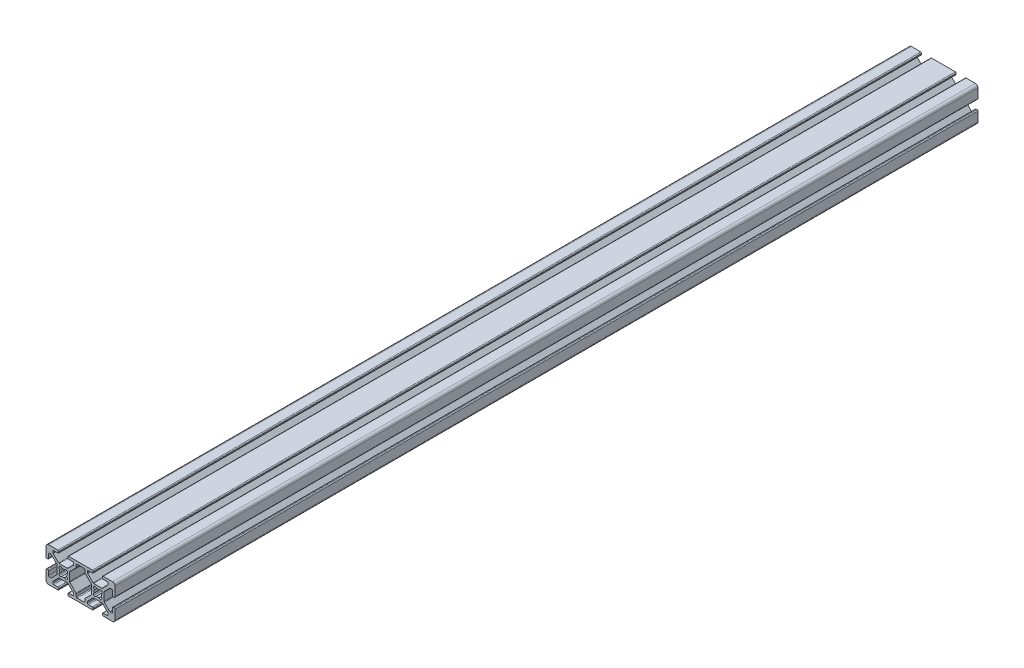
from build123d import *

# Parameters (mm, degrees)
EXTRUDE1_DEPTH = 500


with BuildPart() as part:
    # Sketch1 → Extrude1 (new body)
    with BuildSketch(Plane.XY):
        with BuildLine():
            Line((-36.908207136, -63.334998016), (-32.140368459, -63.334998016))
            ThreePointArc((-32.140368459, -63.334998016), (-31.945965275, -63.373667213), (-31.781158214, -63.483787771))
            Line((-31.781158214, -63.483787771), (-28.678077553, -66.586868432))
            ThreePointArc((-28.678077553, -66.586868432), (-28.567956995, -66.751675493), (-28.529287798, -66.946078677))
            Line((-28.529287798, -66.946078677), (-28.529287798, -67.671998016))
            ThreePointArc((-28.529287798, -67.671998016), (-28.678077553, -68.03120826), (-29.037287798, -68.179998016))
            Line((-29.037287798, -68.179998016), (-31.386287798, -68.179998016))
            ThreePointArc((-31.386287798, -68.179998016), (-31.745498042, -68.328787771), (-31.894287798, -68.687998016))
            Line((-31.894287798, -68.687998016), (-31.894287798, -69.171998016))
            ThreePointArc((-31.894287798, -69.171998016), (-31.745498042, -69.53120826), (-31.386287798, -69.679998016))
            Line((-31.386287798, -69.679998016), (-17.662287798, -69.679998016))
            ThreePointArc((-17.662287798, -69.679998016), (-17.303077553, -69.53120826), (-17.154287798, -69.171998016))
            Line((-17.154287798, -69.171998016), (-17.154287798, -68.687998016))
            ThreePointArc((-17.154287798, -68.687998016), (-17.303077553, -68.328787771), (-17.662287798, -68.179998016))
            Line((-17.662287798, -68.179998016), (-20.011287798, -68.179998016))
            ThreePointArc((-20.011287798, -68.179998016), (-20.370498042, -68.03120826), (-20.519287798, -67.671998016))
            Line((-20.519287798, -67.671998016), (-20.519287798, -66.946078677))
            ThreePointArc((-20.519287798, -66.946078677), (-20.4806186, -66.751675493), (-20.370498042, -66.586868432))
            Line((-20.370498042, -66.586868432), (-17.267417381, -63.483787771))
            ThreePointArc((-17.267417381, -63.483787771), (-17.10261032, -63.373667213), (-16.908207136, -63.334998016))
            Line((-16.908207136, -63.334998016), (-12.140368459, -63.334998016))
            ThreePointArc((-12.140368459, -63.334998016), (-11.945965275, -63.373667213), (-11.781158214, -63.483787771))
            Line((-11.781158214, -63.483787771), (-8.678077553, -66.586868432))
            ThreePointArc((-8.678077553, -66.586868432), (-8.567956995, -66.751675493), (-8.529287798, -66.946078677))
            Line((-8.529287798, -66.946078677), (-8.529287798, -67.671998016))
            ThreePointArc((-8.529287798, -67.671998016), (-8.678077553, -68.03120826), (-9.037287798, -68.179998016))
            Line((-9.037287798, -68.179998016), (-11.386287798, -68.179998016))
            ThreePointArc((-11.386287798, -68.179998016), (-11.745498042, -68.328787771), (-11.894287798, -68.687998016))
            Line((-11.894287798, -68.687998016), (-11.894287798, -69.171998016))
            ThreePointArc((-11.894287798, -69.171998016), (-11.745498042, -69.53120826), (-11.386287798, -69.679998016))
            Line((-11.386287798, -69.679998016), (-6.024287798, -69.679998016))
            ThreePointArc((-6.024287798, -69.679998016), (-4.963627626, -69.240658187), (-4.524287798, -68.179998016))
            Line((-4.524287798, -68.179998016), (-4.524287798, -62.817998016))
            ThreePointArc((-4.524287798, -62.817998016), (-4.673077553, -62.458787771), (-5.032287798, -62.309998016))
            Line((-5.032287798, -62.309998016), (-5.516287798, -62.309998016))
            ThreePointArc((-5.516287798, -62.309998016), (-5.875498042, -62.458787771), (-6.024287798, -62.817998016))
            Line((-6.024287798, -62.817998016), (-6.024287798, -65.166998016))
            ThreePointArc((-6.024287798, -65.166998016), (-6.173077553, -65.52620826), (-6.532287798, -65.674998016))
            Line((-6.532287798, -65.674998016), (-7.258207136, -65.674998016))
            ThreePointArc((-7.258207136, -65.674998016), (-7.45261032, -65.636328818), (-7.617417381, -65.52620826))
            Line((-7.617417381, -65.52620826), (-10.720498042, -62.423127599))
            ThreePointArc((-10.720498042, -62.423127599), (-10.8306186, -62.258320538), (-10.869287798, -62.063917354))
            Line((-10.869287798, -62.063917354), (-10.869287798, -57.296078677))
            ThreePointArc((-10.869287798, -57.296078677), (-10.8306186, -57.101675493), (-10.720498042, -56.936868432))
            Line((-10.720498042, -56.936868432), (-7.617417381, -53.833787771))
            ThreePointArc((-7.617417381, -53.833787771), (-7.45261032, -53.723667213), (-7.258207136, -53.684998016))
            Line((-7.258207136, -53.684998016), (-6.532287798, -53.684998016))
            ThreePointArc((-6.532287798, -53.684998016), (-6.173077553, -53.833787771), (-6.024287798, -54.192998016))
            Line((-6.024287798, -54.192998016), (-6.024287798, -56.541998016))
            ThreePointArc((-6.024287798, -56.541998016), (-5.875498042, -56.90120826), (-5.516287798, -57.049998016))
            Line((-5.516287798, -57.049998016), (-5.032287798, -57.049998016))
            ThreePointArc((-5.032287798, -57.049998016), (-4.673077553, -56.90120826), (-4.524287798, -56.541998016))
            Line((-4.524287798, -56.541998016), (-4.524287798, -51.179998016))
            ThreePointArc((-4.524287798, -51.179998016), (-4.963627626, -50.119337844), (-6.024287798, -49.679998016))
            Line((-6.024287798, -49.679998016), (-11.386287798, -49.679998016))
            ThreePointArc((-11.386287798, -49.679998016), (-11.745498042, -49.828787771), (-11.894287798, -50.187998016))
            Line((-11.894287798, -50.187998016), (-11.894287798, -50.671998016))
            ThreePointArc((-11.894287798, -50.671998016), (-11.745498042, -51.03120826), (-11.386287798, -51.179998016))
            Line((-11.386287798, -51.179998016), (-9.037287798, -51.179998016))
            ThreePointArc((-9.037287798, -51.179998016), (-8.678077553, -51.328787771), (-8.529287798, -51.687998016))
            Line((-8.529287798, -51.687998016), (-8.529287798, -52.413917354))
            ThreePointArc((-8.529287798, -52.413917354), (-8.567956995, -52.608320538), (-8.678077553, -52.773127599))
            Line((-8.678077553, -52.773127599), (-11.781158214, -55.87620826))
            ThreePointArc((-11.781158214, -55.87620826), (-11.945965275, -55.986328818), (-12.140368459, -56.024998016))
            Line((-12.140368459, -56.024998016), (-16.908207136, -56.024998016))
            ThreePointArc((-16.908207136, -56.024998016), (-17.10261032, -55.986328818), (-17.267417381, -55.87620826))
            Line((-17.267417381, -55.87620826), (-20.370498042, -52.773127599))
            ThreePointArc((-20.370498042, -52.773127599), (-20.4806186, -52.608320538), (-20.519287798, -52.413917354))
            Line((-20.519287798, -52.413917354), (-20.519287798, -51.687998016))
            ThreePointArc((-20.519287798, -51.687998016), (-20.370498042, -51.328787771), (-20.011287798, -51.179998016))
            Line((-20.011287798, -51.179998016), (-17.662287798, -51.179998016))
            ThreePointArc((-17.662287798, -51.179998016), (-17.303077553, -51.03120826), (-17.154287798, -50.671998016))
            Line((-17.154287798, -50.671998016), (-17.154287798, -50.187998016))
            ThreePointArc((-17.154287798, -50.187998016), (-17.303077553, -49.828787771), (-17.662287798, -49.679998016))
            Line((-17.662287798, -49.679998016), (-31.386287798, -49.679998016))
            ThreePointArc((-31.386287798, -49.679998016), (-31.745498042, -49.828787771), (-31.894287798, -50.187998016))
            Line((-31.894287798, -50.187998016), (-31.894287798, -50.671998016))
            ThreePointArc((-31.894287798, -50.671998016), (-31.745498042, -51.03120826), (-31.386287798, -51.179998016))
            Line((-31.386287798, -51.179998016), (-29.037287798, -51.179998016))
            ThreePointArc((-29.037287798, -51.179998016), (-28.678077553, -51.328787771), (-28.529287798, -51.687998016))
            Line((-28.529287798, -51.687998016), (-28.529287798, -52.413917354))
            ThreePointArc((-28.529287798, -52.413917354), (-28.567956995, -52.608320538), (-28.678077553, -52.773127599))
            Line((-28.678077553, -52.773127599), (-31.781158214, -55.87620826))
            ThreePointArc((-31.781158214, -55.87620826), (-31.945965275, -55.986328818), (-32.140368459, -56.024998016))
            Line((-32.140368459, -56.024998016), (-36.908207136, -56.024998016))
            ThreePointArc((-36.908207136, -56.024998016), (-37.10261032, -55.986328818), (-37.267417381, -55.87620826))
            Line((-37.267417381, -55.87620826), (-40.370498042, -52.773127599))
            ThreePointArc((-40.370498042, -52.773127599), (-40.4806186, -52.608320538), (-40.519287798, -52.413917354))
            Line((-40.519287798, -52.413917354), (-40.519287798, -51.687998016))
            ThreePointArc((-40.519287798, -51.687998016), (-40.370498042, -51.328787771), (-40.011287798, -51.179998016))
            Line((-40.011287798, -51.179998016), (-37.662287798, -51.179998016))
            ThreePointArc((-37.662287798, -51.179998016), (-37.303077553, -51.03120826), (-37.154287798, -50.671998016))
            Line((-37.154287798, -50.671998016), (-37.154287798, -50.187998016))
            ThreePointArc((-37.154287798, -50.187998016), (-37.303077553, -49.828787771), (-37.662287798, -49.679998016))
            Line((-37.662287798, -49.679998016), (-43.024287798, -49.679998016))
            ThreePointArc((-43.024287798, -49.679998016), (-44.084947969, -50.119337844), (-44.524287798, -51.179998016))
            Line((-44.524287798, -51.179998016), (-44.524287798, -56.541998016))
            ThreePointArc((-44.524287798, -56.541998016), (-44.375498042, -56.90120826), (-44.016287798, -57.049998016))
            Line((-44.016287798, -57.049998016), (-43.532287798, -57.049998016))
            ThreePointArc((-43.532287798, -57.049998016), (-43.173077553, -56.90120826), (-43.024287798, -56.541998016))
            Line((-43.024287798, -56.541998016), (-43.024287798, -54.192998016))
            ThreePointArc((-43.024287798, -54.192998016), (-42.875498042, -53.833787771), (-42.516287798, -53.684998016))
            Line((-42.516287798, -53.684998016), (-41.790368459, -53.684998016))
            ThreePointArc((-41.790368459, -53.684998016), (-41.595965275, -53.723667213), (-41.431158214, -53.833787771))
            Line((-41.431158214, -53.833787771), (-38.328077553, -56.936868432))
            ThreePointArc((-38.328077553, -56.936868432), (-38.217956995, -57.101675493), (-38.179287798, -57.296078677))
            Line((-38.179287798, -57.296078677), (-38.179287798, -62.063917354))
            ThreePointArc((-38.179287798, -62.063917354), (-38.217956995, -62.258320538), (-38.328077553, -62.423127599))
            Line((-38.328077553, -62.423127599), (-41.431158214, -65.52620826))
            ThreePointArc((-41.431158214, -65.52620826), (-41.595965275, -65.636328818), (-41.790368459, -65.674998016))
            Line((-41.790368459, -65.674998016), (-42.516287798, -65.674998016))
            ThreePointArc((-42.516287798, -65.674998016), (-42.875498042, -65.52620826), (-43.024287798, -65.166998016))
            Line((-43.024287798, -65.166998016), (-43.024287798, -62.817998016))
            ThreePointArc((-43.024287798, -62.817998016), (-43.173077553, -62.458787771), (-43.532287798, -62.309998016))
            Line((-43.532287798, -62.309998016), (-44.016287798, -62.309998016))
            ThreePointArc((-44.016287798, -62.309998016), (-44.375498042, -62.458787771), (-44.524287798, -62.817998016))
            Line((-44.524287798, -62.817998016), (-44.524287798, -68.179998016))
            ThreePointArc((-44.524287798, -68.179998016), (-44.084947969, -69.240658187), (-43.024287798, -69.679998016))
            Line((-43.024287798, -69.679998016), (-37.662287798, -69.679998016))
            ThreePointArc((-37.662287798, -69.679998016), (-37.303077553, -69.53120826), (-37.154287798, -69.171998016))
            Line((-37.154287798, -69.171998016), (-37.154287798, -68.687998016))
            ThreePointArc((-37.154287798, -68.687998016), (-37.303077553, -68.328787771), (-37.662287798, -68.179998016))
            Line((-37.662287798, -68.179998016), (-40.011287798, -68.179998016))
            ThreePointArc((-40.011287798, -68.179998016), (-40.370498042, -68.03120826), (-40.519287798, -67.671998016))
            Line((-40.519287798, -67.671998016), (-40.519287798, -66.946078677))
            ThreePointArc((-40.519287798, -66.946078677), (-40.4806186, -66.751675493), (-40.370498042, -66.586868432))
            Line((-40.370498042, -66.586868432), (-37.267417381, -63.483787771))
            ThreePointArc((-37.267417381, -63.483787771), (-37.10261032, -63.373667213), (-36.908207136, -63.334998016))
        make_face()
        with BuildLine():
            Line((-16.649188641, -61.984503982), (-16.828793764, -61.804898859))
            ThreePointArc((-16.828793764, -61.804898859), (-17.030225814, -61.036465826), (-16.459421304, -60.483974734))
            ThreePointArc((-16.459421304, -60.483974734), (-16.619787798, -59.679998016), (-16.459421304, -58.876021298))
            ThreePointArc((-16.459421304, -58.876021298), (-17.030225814, -58.323530205), (-16.828793764, -57.555097172))
            Line((-16.828793764, -57.555097172), (-16.649188641, -57.375492049))
            ThreePointArc((-16.649188641, -57.375492049), (-15.880755608, -57.174059999), (-15.328264516, -57.744864509))
            ThreePointArc((-15.328264516, -57.744864509), (-14.524287798, -57.584498016), (-13.72031108, -57.744864509))
            ThreePointArc((-13.72031108, -57.744864509), (-13.167819987, -57.174059999), (-12.399386954, -57.375492049))
            Line((-12.399386954, -57.375492049), (-12.219781831, -57.555097172))
            ThreePointArc((-12.219781831, -57.555097172), (-12.018349781, -58.323530205), (-12.589154291, -58.876021298))
            ThreePointArc((-12.589154291, -58.876021298), (-12.428787798, -59.679998016), (-12.589154291, -60.483974734))
            ThreePointArc((-12.589154291, -60.483974734), (-12.018349781, -61.036465826), (-12.219781831, -61.804898859))
            Line((-12.219781831, -61.804898859), (-12.399386954, -61.984503982))
            ThreePointArc((-12.399386954, -61.984503982), (-13.167819987, -62.185936032), (-13.72031108, -61.615131522))
            ThreePointArc((-13.72031108, -61.615131522), (-14.524287798, -61.775498016), (-15.328264516, -61.615131522))
            ThreePointArc((-15.328264516, -61.615131522), (-15.880755608, -62.185936032), (-16.649188641, -61.984503982))
        make_face(mode=Mode.SUBTRACT)
        with BuildLine():
            Line((-27.029287798, -67.671998016), (-27.029287798, -66.324758333))
            ThreePointArc((-27.029287798, -66.324758333), (-27.067956995, -66.13035515), (-27.178077553, -65.965548089))
            Line((-27.178077553, -65.965548089), (-30.720498042, -62.423127599))
            ThreePointArc((-30.720498042, -62.423127599), (-30.8306186, -62.258320538), (-30.869287798, -62.063917354))
            Line((-30.869287798, -62.063917354), (-30.869287798, -57.296078677))
            ThreePointArc((-30.869287798, -57.296078677), (-30.8306186, -57.101675493), (-30.720498042, -56.936868432))
            Line((-30.720498042, -56.936868432), (-27.178077553, -53.394447942))
            ThreePointArc((-27.178077553, -53.394447942), (-27.067956995, -53.229640881), (-27.029287798, -53.035237698))
            Line((-27.029287798, -53.035237698), (-27.029287798, -51.687998016))
            ThreePointArc((-27.029287798, -51.687998016), (-26.880498042, -51.328787771), (-26.521287798, -51.179998016))
            Line((-26.521287798, -51.179998016), (-22.527287798, -51.179998016))
            ThreePointArc((-22.527287798, -51.179998016), (-22.168077553, -51.328787771), (-22.019287798, -51.687998016))
            Line((-22.019287798, -51.687998016), (-22.019287798, -53.035237698))
            ThreePointArc((-22.019287798, -53.035237698), (-21.9806186, -53.229640881), (-21.870498042, -53.394447942))
            Line((-21.870498042, -53.394447942), (-18.328077553, -56.936868432))
            ThreePointArc((-18.328077553, -56.936868432), (-18.217956995, -57.101675493), (-18.179287798, -57.296078677))
            Line((-18.179287798, -57.296078677), (-18.179287798, -62.063917354))
            ThreePointArc((-18.179287798, -62.063917354), (-18.217956995, -62.258320538), (-18.328077553, -62.423127599))
            Line((-18.328077553, -62.423127599), (-21.870498042, -65.965548089))
            ThreePointArc((-21.870498042, -65.965548089), (-21.9806186, -66.13035515), (-22.019287798, -66.324758333))
            Line((-22.019287798, -66.324758333), (-22.019287798, -67.671998016))
            ThreePointArc((-22.019287798, -67.671998016), (-22.168077553, -68.03120826), (-22.527287798, -68.179998016))
            Line((-22.527287798, -68.179998016), (-26.521287798, -68.179998016))
            ThreePointArc((-26.521287798, -68.179998016), (-26.880498042, -68.03120826), (-27.029287798, -67.671998016))
        make_face(mode=Mode.SUBTRACT)
        with BuildLine():
            Line((-36.649188641, -61.984503982), (-36.828793764, -61.804898859))
            ThreePointArc((-36.828793764, -61.804898859), (-37.030225814, -61.036465826), (-36.459421304, -60.483974734))
            ThreePointArc((-36.459421304, -60.483974734), (-36.619787798, -59.679998016), (-36.459421304, -58.876021298))
            ThreePointArc((-36.459421304, -58.876021298), (-37.030225814, -58.323530205), (-36.828793764, -57.555097172))
            Line((-36.828793764, -57.555097172), (-36.649188641, -57.375492049))
            ThreePointArc((-36.649188641, -57.375492049), (-35.880755608, -57.174059999), (-35.328264516, -57.744864509))
            ThreePointArc((-35.328264516, -57.744864509), (-34.524287798, -57.584498016), (-33.72031108, -57.744864509))
            ThreePointArc((-33.72031108, -57.744864509), (-33.167819987, -57.174059999), (-32.399386954, -57.375492049))
            Line((-32.399386954, -57.375492049), (-32.219781831, -57.555097172))
            ThreePointArc((-32.219781831, -57.555097172), (-32.018349781, -58.323530205), (-32.589154291, -58.876021298))
            ThreePointArc((-32.589154291, -58.876021298), (-32.428787798, -59.679998016), (-32.589154291, -60.483974734))
            ThreePointArc((-32.589154291, -60.483974734), (-32.018349781, -61.036465826), (-32.219781831, -61.804898859))
            Line((-32.219781831, -61.804898859), (-32.399386954, -61.984503982))
            ThreePointArc((-32.399386954, -61.984503982), (-33.167819987, -62.185936032), (-33.72031108, -61.615131522))
            ThreePointArc((-33.72031108, -61.615131522), (-34.524287798, -61.775498016), (-35.328264516, -61.615131522))
            ThreePointArc((-35.328264516, -61.615131522), (-35.880755608, -62.185936032), (-36.649188641, -61.984503982))
        make_face(mode=Mode.SUBTRACT)
    extrude(amount=EXTRUDE1_DEPTH)


solid = part.part
